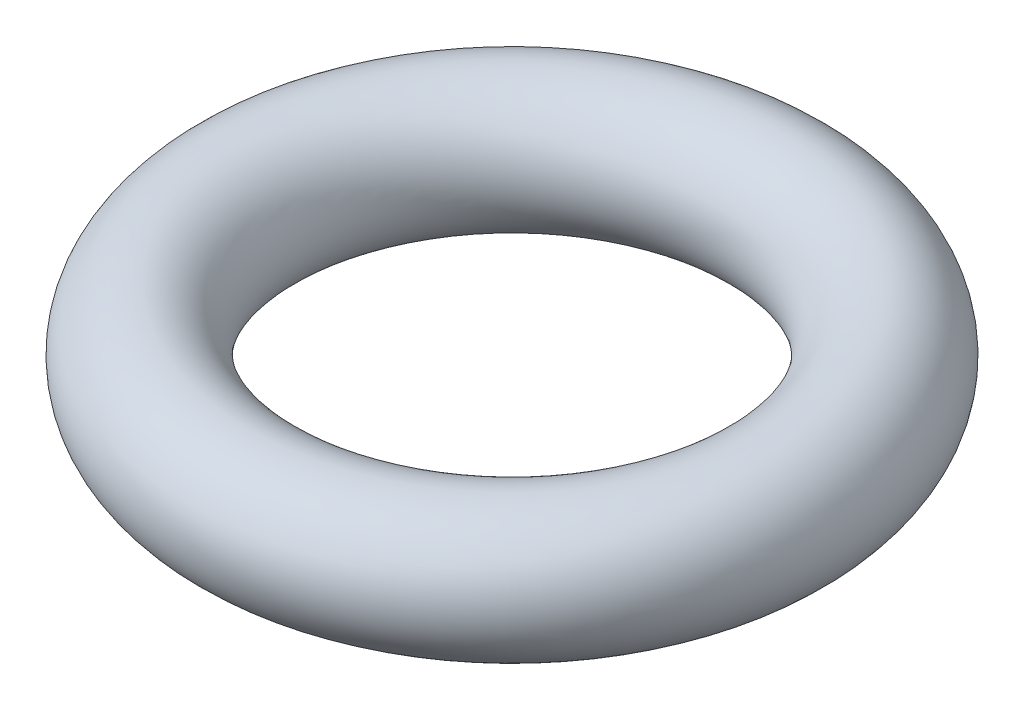
from build123d import *

# Parameters (mm, degrees)
SKETCH1_R = 0.79375


with BuildPart() as part:
    # Sketch1 → AS568-008 (revolve)
    with BuildSketch(Plane.XY, mode=Mode.PRIVATE) as as568_008_sk:
        with Locations((3.175, 0)):
            Circle(SKETCH1_R)
    revolve(as568_008_sk.sketch.rotate(Axis((0, 0, 0), (0, 1, 0)), 90), axis=Axis((0, 0, 0), (0, 1, 0)))


solid = part.part
